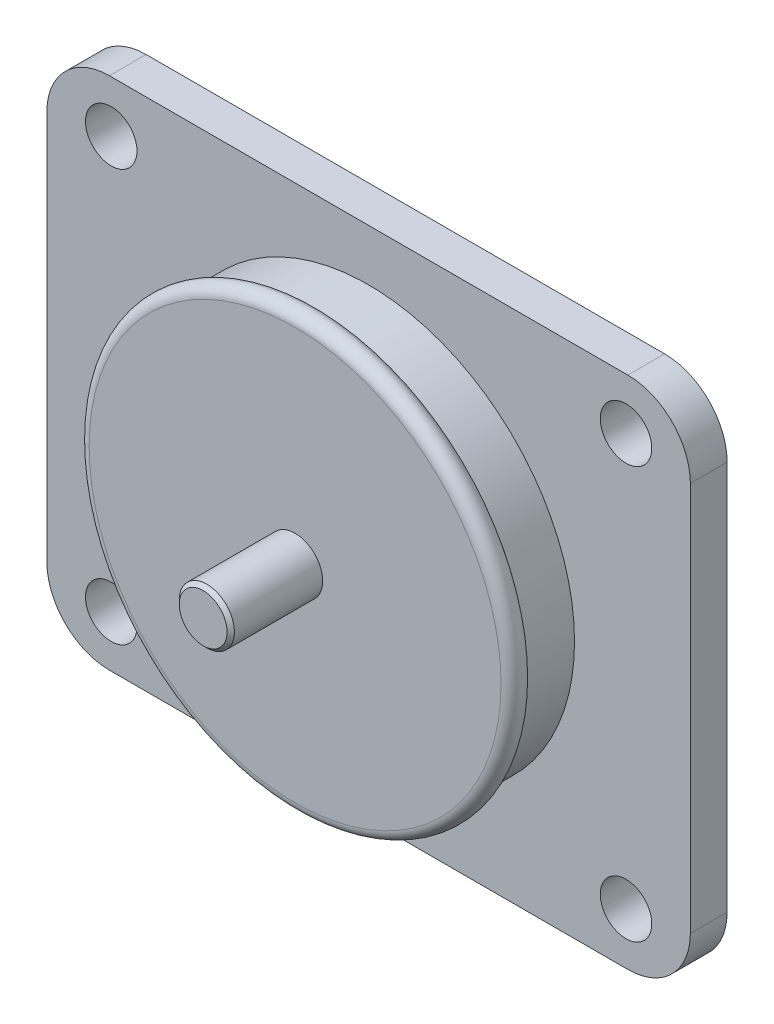
from build123d import *

# Parameters (mm, degrees)
SKETCH1_R           = 7
BOSS_EXTRUDE1_DEPTH = 10
SKETCH2_R           = 56
BOSS_EXTRUDE2_DEPTH = 20
SKETCH3_R           = 3
SKETCH4_R           = 7.5
BOSS_EXTRUDE3_DEPTH = 25
CHAMFER1_SIZE       = 1
SKETCH5_R           = 45
CUT_EXTRUDE1_DEPTH  = 2
SCALE1_SCALE        = 0.25


with BuildPart() as part:
    # Sketch1 → Boss-Extrude1 (new body)
    with BuildSketch(Plane.XY):
        with BuildLine():
            Line((-70.5, 70), (70.5, 70))
            ThreePointArc((70.5, 70), (82.52081528, 65.02081528), (87.5, 53))
            Line((87.5, 53), (87.5, -53))
            ThreePointArc((87.5, -53), (82.52081528, -65.02081528), (70.5, -70))
            Line((70.5, -70), (-70.5, -70))
            ThreePointArc((-70.5, -70), (-82.52081528, -65.02081528), (-87.5, -53))
            Line((-87.5, -53), (-87.5, 53))
            ThreePointArc((-87.5, 53), (-82.52081528, 65.02081528), (-70.5, 70))
        make_face()
        with Locations((-70, 56)):
            Circle(SKETCH1_R, mode=Mode.SUBTRACT)
        with Locations((-70, -56)):
            Circle(SKETCH1_R, mode=Mode.SUBTRACT)
        with Locations((70, -56)):
            Circle(SKETCH1_R, mode=Mode.SUBTRACT)
        with Locations((70, 56)):
            Circle(SKETCH1_R, mode=Mode.SUBTRACT)
    extrude(amount=BOSS_EXTRUDE1_DEPTH)

    # Sketch2 → Boss-Extrude2 (add)
    with BuildSketch(Plane.XY.offset(10)):
        Circle(SKETCH2_R)
    extrude(amount=BOSS_EXTRUDE2_DEPTH)

    # Sketch3 → Revolve1 (revolve)
    with BuildSketch(Plane(origin=(0, 0, 0), x_dir=(1, 0, 0), z_dir=(0, 1, 0)), mode=Mode.PRIVATE) as revolve1_sk:
        with Locations((-56, -27)):
            Circle(SKETCH3_R)
    revolve(revolve1_sk.sketch.rotate(Axis((0, 0, 0), (0, 0, 1)), 180), axis=Axis((0, 0, 0), (0, 0, 1)))

    # Sketch4 → Boss-Extrude3 (add)
    with BuildSketch(Plane.XY.offset(30)):
        Circle(SKETCH4_R)
    extrude(amount=BOSS_EXTRUDE3_DEPTH)

    # Chamfer1
    chamfer1_edges = [part.edges().sort_by_distance(p)[0] for p in [
        (-7.5, 0, 55),
    ]]
    chamfer(chamfer1_edges, length=CHAMFER1_SIZE)

    # Sketch5 → Cut-Extrude1 (cut)
    with BuildSketch(Plane(origin=(0, 0, 0), x_dir=(-1, 0, 0), z_dir=(0, 0, -1))):
        Circle(SKETCH5_R)
    extrude(amount=-CUT_EXTRUDE1_DEPTH, mode=Mode.SUBTRACT)


with BuildPart() as part_1:
    # Scale1: scaled about (0, 0, 12.631964086)
    add(part.part.scale(SCALE1_SCALE).moved(Location((0, 0, 9.473973065))))


solid = part_1.part
